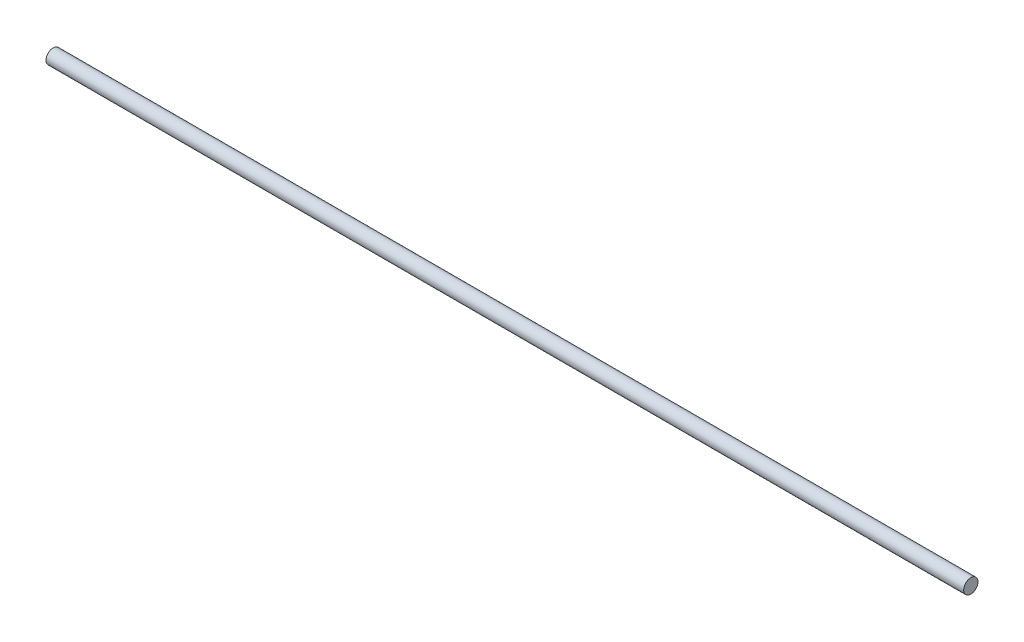
from build123d import *

# Parameters (mm, degrees)
SKETCH1_R           = 1.984375
BOSS_EXTRUDE1_DEPTH = 127


with BuildPart() as part:
    # Sketch1 → Boss-Extrude1 (new, symmetric)
    with BuildSketch(Plane(origin=(0, 0, 0), x_dir=(0, 0, -1), z_dir=(1, 0, 0))):
        Circle(SKETCH1_R)
    extrude(amount=BOSS_EXTRUDE1_DEPTH, both=True)


solid = part.part
